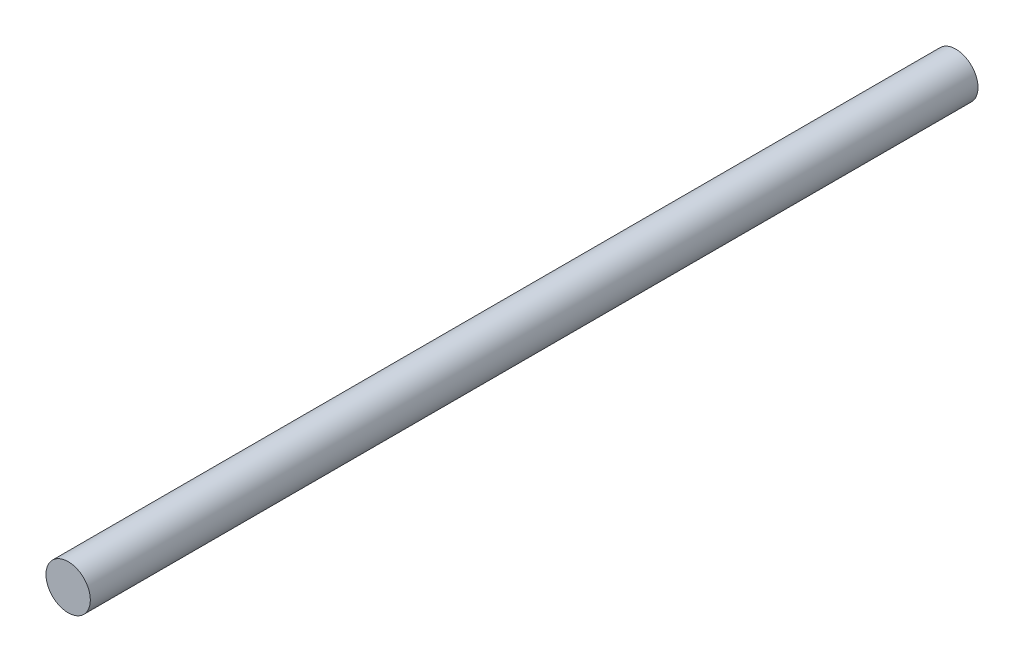
from build123d import *

# Parameters (mm, degrees)
SKETCH_1_R      = 0.5
EXTRUDE_1_DEPTH = 20


with BuildPart() as part:
    # 草图1 → 凸台-拉伸1 (new body)
    with BuildSketch(Plane.XY):
        Circle(SKETCH_1_R)
    extrude(amount=EXTRUDE_1_DEPTH)


solid = part.part
